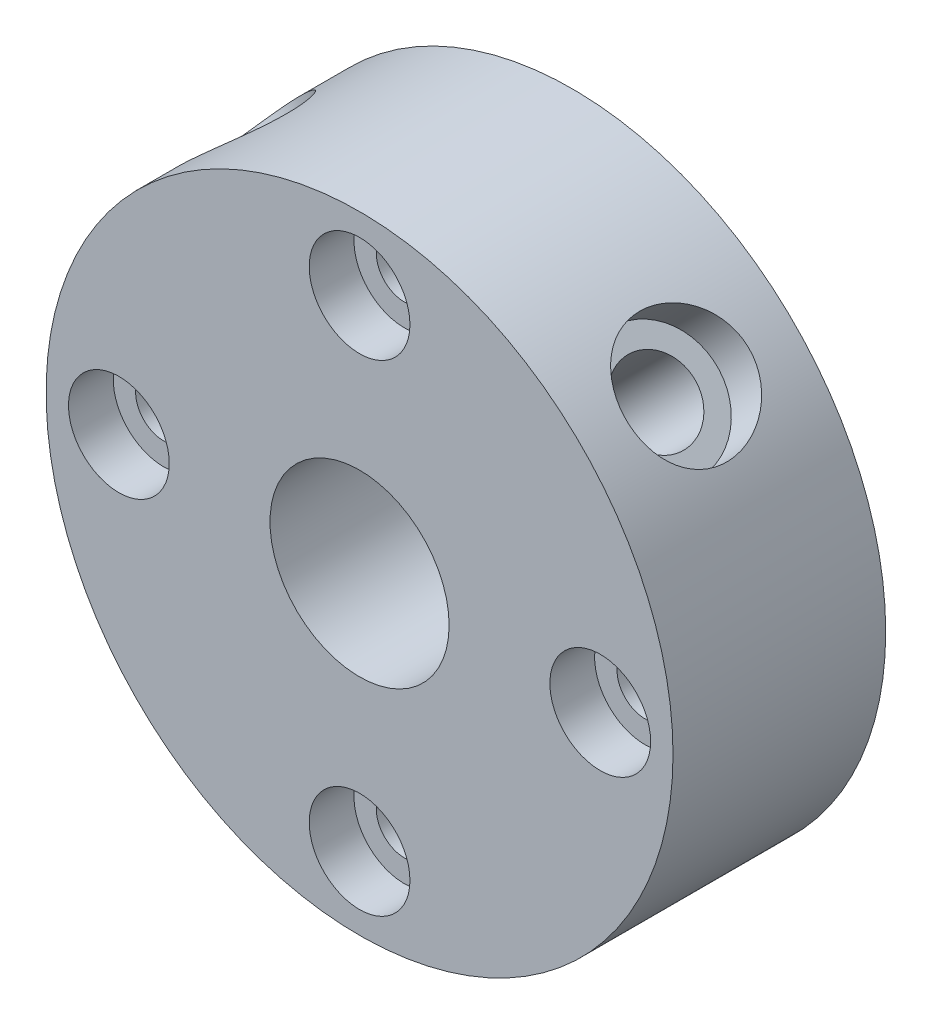
from build123d import *

# Parameters (mm, degrees)
SKETCH1_R           = 14
BOSS_EXTRUDE1_DEPTH = 2
SKETCH2_R           = 14
SKETCH2_R_2         = 4
BOSS_EXTRUDE2_DEPTH = 7.5
SKETCH3_R           = 7.5
CUT_EXTRUDE1_DEPTH  = 2
SKETCH5_R           = 1.25
CUT_EXTRUDE2_DEPTH  = 22.960191256
SKETCH7_R           = 1.75
CUT_EXTRUDE3_DEPTH  = 15
SKETCH9_R           = 1.75
CUT_EXTRUDE4_DEPTH  = 15
SKETCH10_R          = 2.25
CUT_EXTRUDE5_DEPTH  = 2
SKETCH11_R          = 2.75
CUT_EXTRUDE6_DEPTH  = 2
SKETCH12_R          = 2.75
CUT_EXTRUDE7_DEPTH  = 2


with BuildPart() as part:
    # Sketch1 → Boss-Extrude1 (new body)
    with BuildSketch(Plane.XY):
        Circle(SKETCH1_R)
    extrude(amount=BOSS_EXTRUDE1_DEPTH)

    # Sketch2 → Boss-Extrude2 (add)
    with BuildSketch(Plane.XY.offset(2)):
        Circle(SKETCH2_R)
        Circle(SKETCH2_R_2, mode=Mode.SUBTRACT)
    extrude(amount=BOSS_EXTRUDE2_DEPTH)

    # Sketch3 → Cut-Extrude1 (cut)
    with BuildSketch(Plane(origin=(0, 0, 0), x_dir=(-1, 0, 0), z_dir=(0, 0, -1))):
        Circle(SKETCH3_R)
    extrude(amount=-CUT_EXTRUDE1_DEPTH, mode=Mode.SUBTRACT)

    # Sketch5 → Cut-Extrude2 (cut, through all)
    with BuildSketch(Plane.XY.offset(9.5)):
        with Locations((0, 10.75)):
            Circle(SKETCH5_R)
        with Locations((10.75, 0)):
            Circle(SKETCH5_R)
        with Locations((0, -10.75)):
            Circle(SKETCH5_R)
        with Locations((-10.75, 0)):
            Circle(SKETCH5_R)
    extrude(amount=-CUT_EXTRUDE2_DEPTH, mode=Mode.SUBTRACT)

    # Sketch7 → Cut-Extrude3 (cut)
    with BuildSketch(Plane(origin=(9.899494937, 9.899494937, 0), x_dir=(0.7071067811865489, -0.7071067811865461, 0), z_dir=(0.7071067811865461, 0.7071067811865489, 0))):
        with Locations((0, -4.75)):
            Circle(SKETCH7_R)
    extrude(amount=-CUT_EXTRUDE3_DEPTH, mode=Mode.SUBTRACT)

    # Sketch9 → Cut-Extrude4 (cut)
    with BuildSketch(Plane(origin=(-9.899494937, 9.899494937, 0), x_dir=(0, 0, 1), z_dir=(-0.7071067811865489, 0.7071067811865462, 0))):
        with Locations((5, 0)):
            Circle(SKETCH9_R)
    extrude(amount=-CUT_EXTRUDE4_DEPTH, mode=Mode.SUBTRACT)

    # Sketch10 → Cut-Extrude5 (cut)
    with BuildSketch(Plane.XY.offset(9.5)):
        with Locations((0, 10.75)):
            Circle(SKETCH10_R)
        with Locations((10.75, 0)):
            Circle(SKETCH10_R)
        with Locations((0, -10.75)):
            Circle(SKETCH10_R)
        with Locations((-10.75, 0)):
            Circle(SKETCH10_R)
    extrude(amount=-CUT_EXTRUDE5_DEPTH, mode=Mode.SUBTRACT)

    # Sketch11 → Cut-Extrude6 (cut)
    with BuildSketch(Plane(origin=(9.899494937, 9.899494937, 0), x_dir=(0.7071067811865489, -0.7071067811865461, 0), z_dir=(0.7071067811865461, 0.7071067811865489, 0))):
        with Locations((0, -4.75)):
            Circle(SKETCH11_R)
    extrude(amount=-CUT_EXTRUDE6_DEPTH, mode=Mode.SUBTRACT)

    # Sketch12 → Cut-Extrude7 (cut)
    with BuildSketch(Plane(origin=(-9.899494937, 9.899494937, 0), x_dir=(0, 0, 1), z_dir=(-0.7071067811865489, 0.7071067811865462, 0))):
        with Locations((5, 0)):
            Circle(SKETCH12_R)
    extrude(amount=-CUT_EXTRUDE7_DEPTH, mode=Mode.SUBTRACT)


solid = part.part
